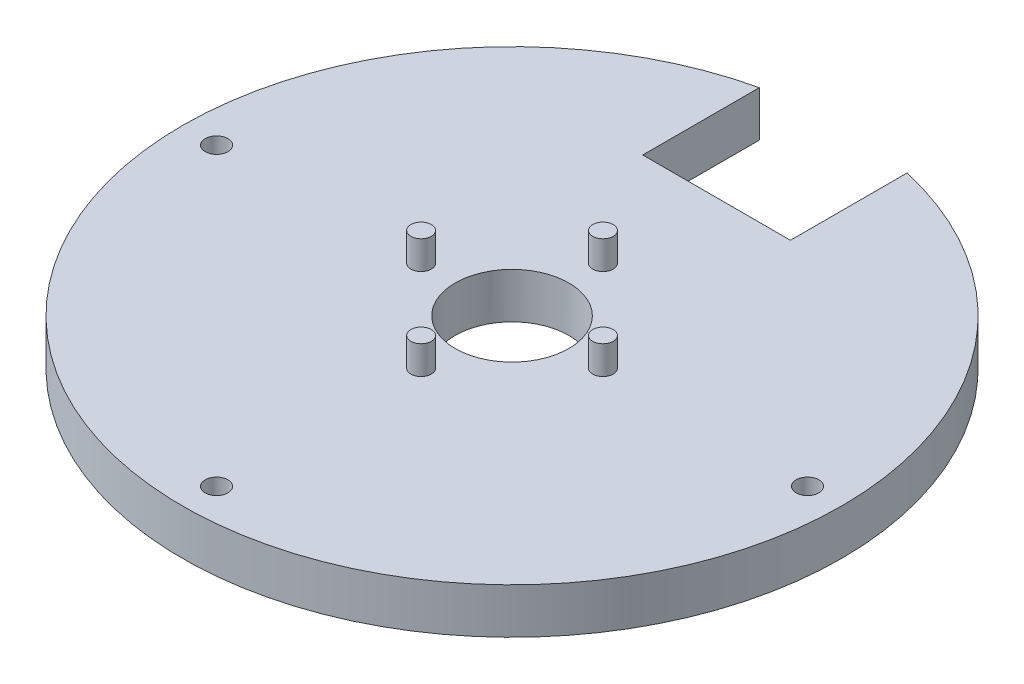
from build123d import *

# Parameters (mm, degrees)
SKETCH1_R           = 29
BOSS_EXTRUDE1_DEPTH = 5
SKETCH3_W           = 13
SKETCH3_H           = 11
CUT_EXTRUDE1_DEPTH  = 10
SKETCH4_R           = 0.9
BOSS_EXTRUDE2_DEPTH = 2.5
SKETCH7_R           = 5
CUT_EXTRUDE4_DEPTH  = 5
SKETCH11_R          = 1
CUT_EXTRUDE6_DEPTH  = 5
SKETCH12_R          = 29
CUT_EXTRUDE7_DEPTH  = 1


with BuildPart() as part:
    # Sketch1 → Boss-Extrude1 (new body)
    with BuildSketch(Plane(origin=(0, 0, 0), x_dir=(1, 0, 0), z_dir=(0, 1, 0))):
        with Locations(Location((0, 0, 0), (0, 0, 270))):
            Circle(SKETCH1_R)
    extrude(amount=BOSS_EXTRUDE1_DEPTH)

    # Sketch3 → Cut-Extrude1 (cut)
    with BuildSketch(Plane(origin=(0, 5, 0), x_dir=(1, 0, 0), z_dir=(0, 1, 0))):
        with Locations((0, 23.5)):
            Rectangle(SKETCH3_W, SKETCH3_H)
    extrude(amount=-CUT_EXTRUDE1_DEPTH, mode=Mode.SUBTRACT)

    # Sketch4 → Boss-Extrude2 (add)
    with BuildSketch(Plane(origin=(0, 5, 0), x_dir=(1, 0, 0), z_dir=(0, 1, 0))):
        with Locations(Location((8, 0, 0), (0, 0, 270))):
            Circle(SKETCH4_R)
        with Locations(Location((-8, 0, 0), (0, 0, 270))):
            Circle(SKETCH4_R)
        with Locations(Location((0, 8, 0), (0, 0, 270))):
            Circle(SKETCH4_R)
        with Locations(Location((0, -8, 0), (0, 0, 270))):
            Circle(SKETCH4_R)
    extrude(amount=BOSS_EXTRUDE2_DEPTH)

    # Sketch7 → Cut-Extrude4 (cut)
    with BuildSketch(Plane(origin=(0, 5, 0), x_dir=(1, 0, 0), z_dir=(0, 1, 0))):
        with Locations(Location((0, 0, 0), (0, 0, 270))):
            Circle(SKETCH7_R)
    extrude(amount=-CUT_EXTRUDE4_DEPTH, mode=Mode.SUBTRACT)

    # Sketch11 → Cut-Extrude6 (cut)
    with BuildSketch(Plane(origin=(0, 5, 0), x_dir=(1, 0, 0), z_dir=(0, 1, 0))):
        with Locations(Location((-26, 0, 0), (0, 0, 270))):
            Circle(SKETCH11_R)
        with Locations(Location((0, -26, 0), (0, 0, 270))):
            Circle(SKETCH11_R)
        with Locations(Location((26, 0, 0), (0, 0, 270))):
            Circle(SKETCH11_R)
    extrude(amount=-CUT_EXTRUDE6_DEPTH, mode=Mode.SUBTRACT)

    # Sketch12 → Cut-Extrude7 (cut)
    with BuildSketch(Plane(origin=(0, 0, 0), x_dir=(-1, 0, 0), z_dir=(0, -1, 0))):
        Circle(SKETCH12_R)
    extrude(amount=-CUT_EXTRUDE7_DEPTH, mode=Mode.SUBTRACT)


solid = part.part
